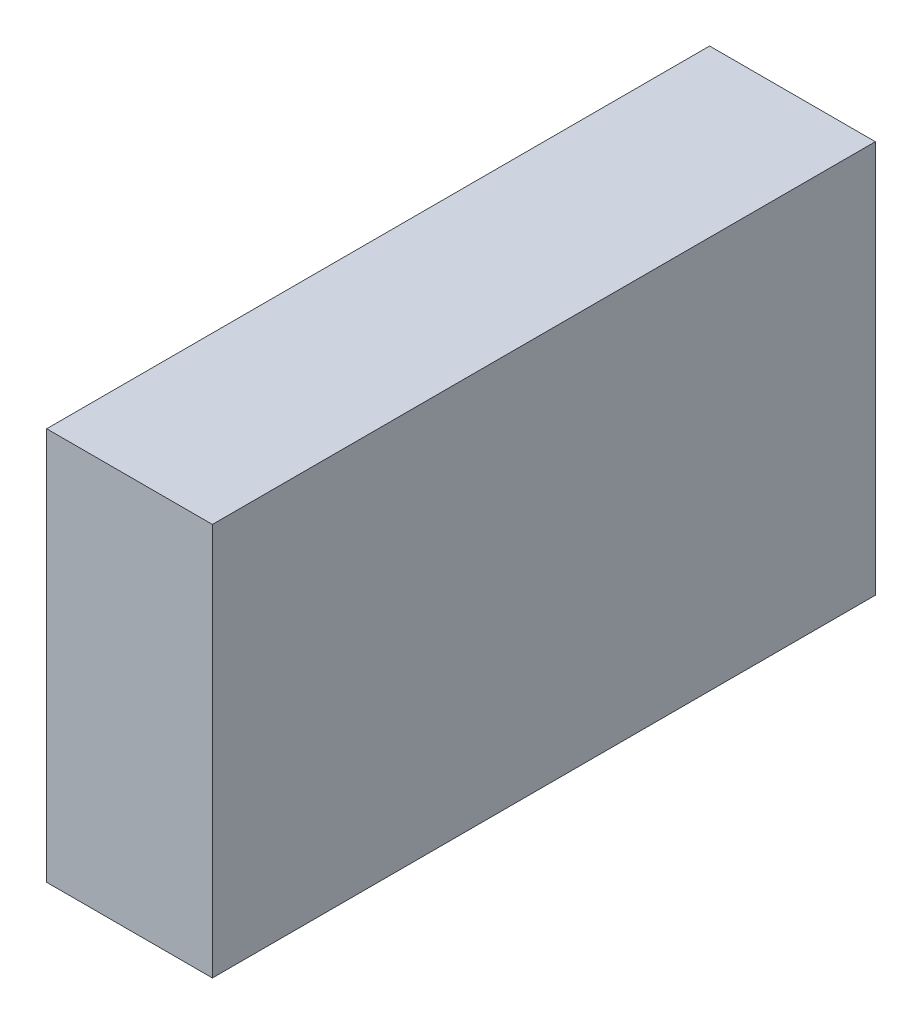
from build123d import *

# Parameters (mm, degrees)
SKETCH1_W           = 40
SKETCH1_H           = 23.7
BOSS_EXTRUDE1_DEPTH = 10


with BuildPart() as part:
    # Sketch1 → Boss-Extrude1 (new body)
    with BuildSketch(Plane(origin=(0, 0, 0), x_dir=(0, 0, -1), z_dir=(1, 0, 0))):
        with Locations((20, 11.85)):
            Rectangle(SKETCH1_W, SKETCH1_H)
    extrude(amount=-BOSS_EXTRUDE1_DEPTH)


solid = part.part
